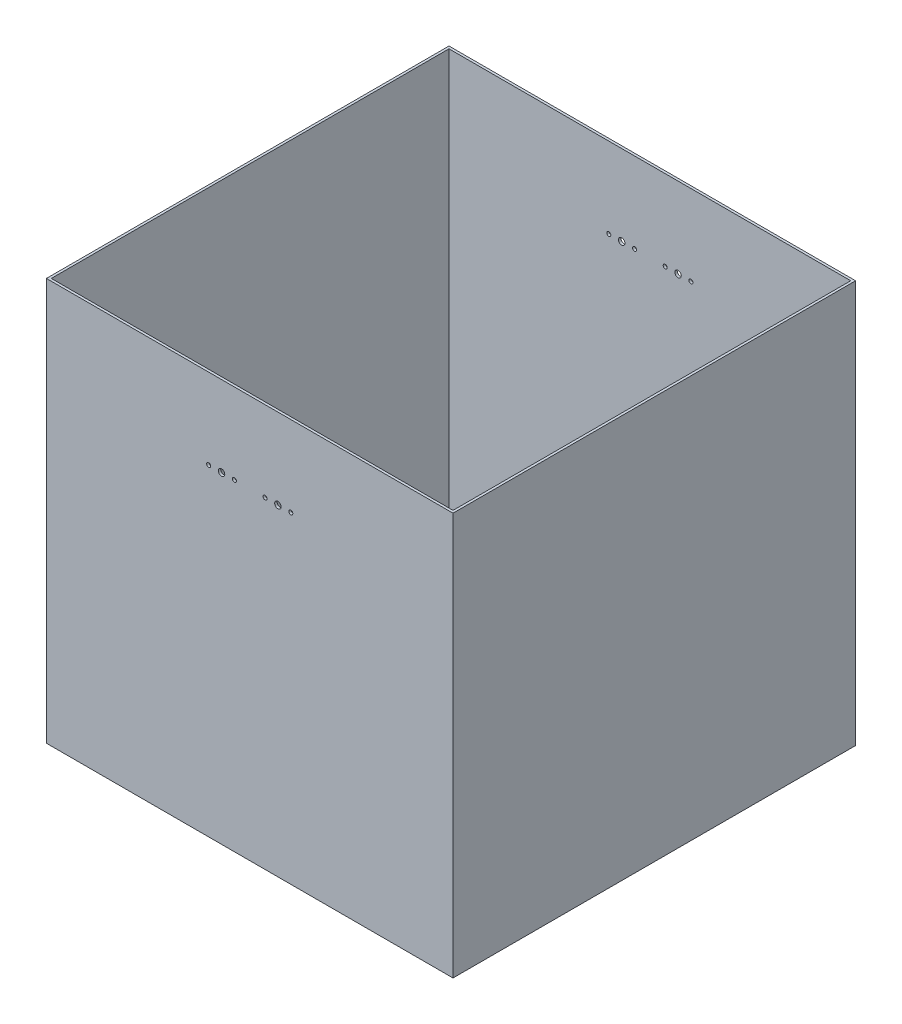
from build123d import *

# Parameters (mm, degrees)
SKETCH1_W               = 505
SKETCH1_H               = 500
SKETCH1_W_2             = 499
SKETCH1_H_2             = 494
BOSS_EXTRUDE1_DEPTH     = 500
CUT_EXTRUDE2_DEPTH      = 751.837032917
CUT_EXTRUDE2_DEPTH_BACK = 751.837032917
SKETCH4_R               = 4
SKETCH4_R_2             = 2.5


with BuildPart() as part:
    # Sketch1 → Boss-Extrude1 (new body)
    with BuildSketch(Plane(origin=(0, 0, 0), x_dir=(1, 0, 0), z_dir=(0, 1, 0))):
        Rectangle(SKETCH1_W, SKETCH1_H)
        Rectangle(SKETCH1_W_2, SKETCH1_H_2, mode=Mode.SUBTRACT)
    extrude(amount=BOSS_EXTRUDE1_DEPTH)

    # Sketch4 → Cut-Extrude2 (cut, two sides: drawn at the far end of the back side and taken through both)
    with BuildSketch(Plane(origin=(0, 0, -250), x_dir=(-1, 0, 0), z_dir=(0, 0, -1)).offset(-CUT_EXTRUDE2_DEPTH_BACK)):
        with Locations((35, 400)):
            Circle(SKETCH4_R)
        with Locations(Location((-35, 400, 0), (0, 0, 180))):
            Circle(SKETCH4_R)
        with Locations((-19, 400)):
            Circle(SKETCH4_R_2)
        with Locations(Location((-51, 400, 0), (0, 0, 180))):
            Circle(SKETCH4_R_2)
        with Locations(Location((19, 400, 0), (0, 0, 180))):
            Circle(SKETCH4_R_2)
        with Locations((51, 400)):
            Circle(SKETCH4_R_2)
    extrude(amount=CUT_EXTRUDE2_DEPTH + CUT_EXTRUDE2_DEPTH_BACK, mode=Mode.SUBTRACT)


solid = part.part
